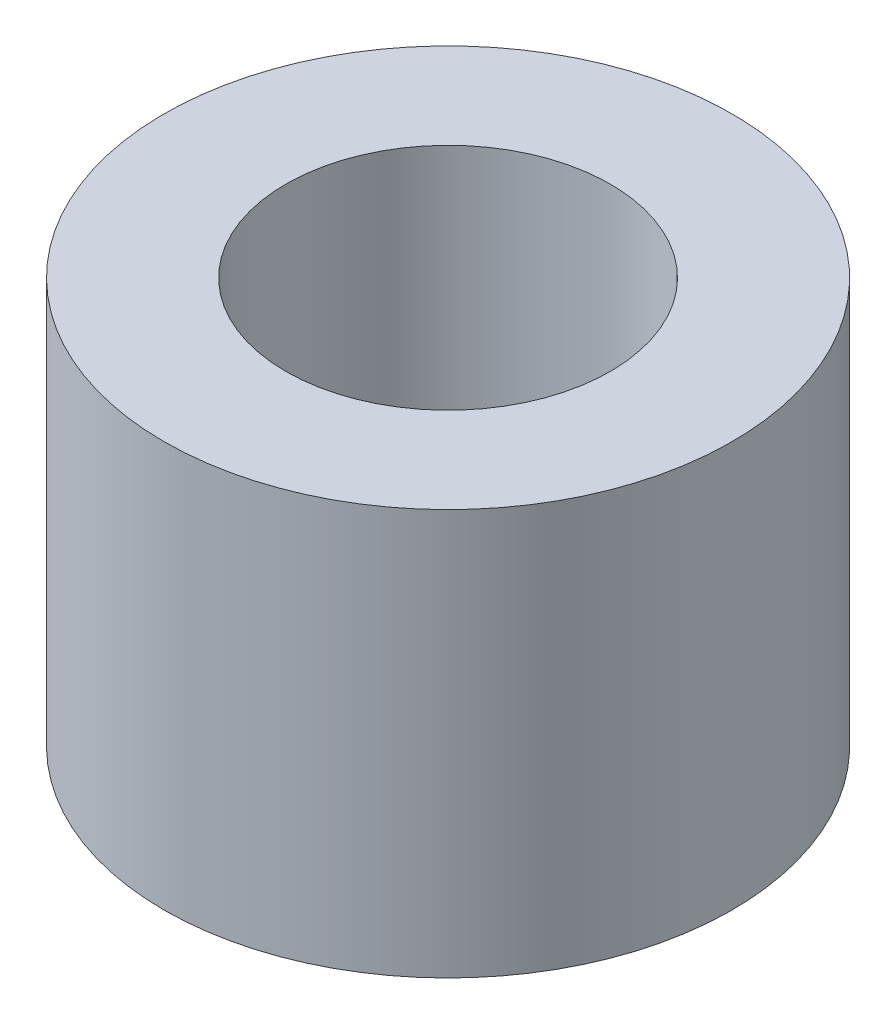
from build123d import *

# Parameters (mm, degrees)
SZKIC1_R                    = 3.5
SZKIC1_R_2                  = 2
DODANIE_WYCI_GNI_CIE1_DEPTH = 5


with BuildPart() as part:
    # Szkic1 → Dodanie-wyciągnięcie1 (new body)
    with BuildSketch(Plane(origin=(0, 0, 0), x_dir=(1, 0, 0), z_dir=(0, 1, 0))):
        with Locations(Location((0, 0, 0), (0, 0, 270))):
            Circle(SZKIC1_R)
        with Locations(Location((0, 0, 0), (0, 0, 270))):
            Circle(SZKIC1_R_2, mode=Mode.SUBTRACT)
    extrude(amount=DODANIE_WYCI_GNI_CIE1_DEPTH)


solid = part.part
